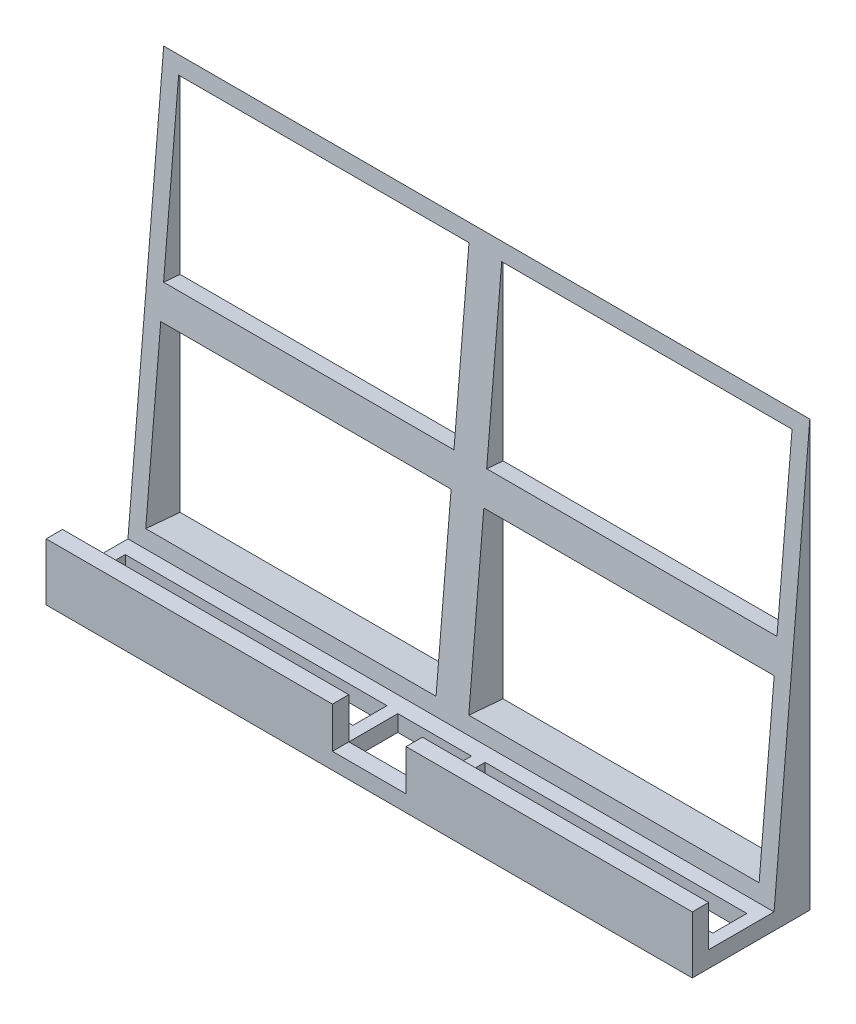
from build123d import *

# Parameters (mm, degrees)
CROQUIS1_W              = 79
CROQUIS1_H              = 14.37
SALIENTE_EXTRUIR1_DEPTH = 2
SALIENTE_EXTRUIR2_DEPTH = 79
CROQUIS4_W              = 35
CROQUIS4_H              = 2
SALIENTE_EXTRUIR3_DEPTH = 5
CORTAR_EXTRUIR1_REACH   = 66.124
CROQUIS5_W              = 9
CROQUIS5_H              = 9.995566824
CORTAR_EXTRUIR2_REACH   = 68.213
CROQUIS6_W              = 35.5
CROQUIS6_H              = 21.095495938
CROQUIS6_H_2            = 21.095495939
CORTAR_EXTRUIR3_REACH   = 66.124
CROQUIS7_W              = 32
CROQUIS7_H              = 4.169878309
SALIENTE_EXTRUIR4_REACH = 70.495
CROQUIS8_W              = 2
CROQUIS8_H              = 2
SALIENTE_EXTRUIR5_REACH = 70.495
CROQUIS11_W             = 2
CROQUIS11_H             = 2


with BuildPart() as part:
    # Croquis1 → Saliente-Extruir1 (new body)
    with BuildSketch(Plane(origin=(0, 0, 0), x_dir=(1, 0, 0), z_dir=(0, 1, 0))):
        Rectangle(CROQUIS1_W, CROQUIS1_H)
    extrude(amount=SALIENTE_EXTRUIR1_DEPTH)

    # Croquis2 → Saliente-Extruir2 (add)
    with BuildSketch(Plane(origin=(39.5, 0, 0), x_dir=(0, 0, -1), z_dir=(1, 0, 0))):
        Polygon((2.810566824, 2), (7.185, 52), (7.185, 2), align=None)
    extrude(amount=-SALIENTE_EXTRUIR2_DEPTH)

    # Croquis4 → Saliente-Extruir3 (add)
    with BuildSketch(Plane(origin=(0, 2, 0), x_dir=(1, 0, 0), z_dir=(0, 1, 0))):
        with Locations((-22, -6.185)):
            Rectangle(CROQUIS4_W, CROQUIS4_H)
    saliente_extruir3 = extrude(amount=SALIENTE_EXTRUIR3_DEPTH)

    # Simetría1: Saliente-Extruir3 across plane
    add(saliente_extruir3.mirror(Plane(origin=(0, 0, 0), x_dir=(0, 0, 1), z_dir=(1, 0, 0))))

    # Croquis5 → Cortar-Extruir1 (cut, up to next)
    with BuildSketch(Plane(origin=(0, 2, 0), x_dir=(1, 0, 0), z_dir=(0, 1, 0)), mode=Mode.PRIVATE) as cortar_extruir1_sk1:
        with Locations((0, -2.187216588)):
            Rectangle(CROQUIS5_W, CROQUIS5_H)
    cortar_extruir1_tool1 = extrude(cortar_extruir1_sk1.sketch, amount=-CORTAR_EXTRUIR1_REACH, mode=Mode.PRIVATE) & part.part
    add(cortar_extruir1_tool1.solids().sort_by_distance((0, 2, 2.187217))[0], mode=Mode.SUBTRACT)

    # Cortar-Extruir2: up to this plane
    cortar_extruir2_end = Plane(origin=(39.5, 2, -7.185), z_dir=(0, 0, 1))
    # Croquis6 → Cortar-Extruir2 (cut, up to the surface)
    with BuildSketch(Plane(origin=(0, -0.228832657, -2.615569233), x_dir=(1, 0, 0), z_dir=(0, 0.0871557427476544, 0.996194698091746)), mode=Mode.PRIVATE) as cortar_extruir2_sk1:
        with Locations((-19.75, 39.880590343)):
            Rectangle(CROQUIS6_W, CROQUIS6_H)
    cortar_extruir2_tool1 = split(extrude(cortar_extruir2_sk1.sketch, amount=-CORTAR_EXTRUIR2_REACH, mode=Mode.PRIVATE), bisect_by=cortar_extruir2_end, keep=Keep.BOTH, mode=Mode.PRIVATE)
    add(cortar_extruir2_tool1.solids().sort_by_distance((-19.75, 39.5, -6.091392))[0], mode=Mode.SUBTRACT)
    # Croquis6 → Cortar-Extruir2 (cut, up to the surface)
    with BuildSketch(Plane(origin=(0, -0.228832657, -2.615569233), x_dir=(1, 0, 0), z_dir=(0, 0.0871557427476544, 0.996194698091746)), mode=Mode.PRIVATE) as cortar_extruir2_sk2:
        with Locations((19.75, 39.880590343)):
            Rectangle(CROQUIS6_W, CROQUIS6_H)
    cortar_extruir2_tool2 = split(extrude(cortar_extruir2_sk2.sketch, amount=-CORTAR_EXTRUIR2_REACH, mode=Mode.PRIVATE), bisect_by=cortar_extruir2_end, keep=Keep.BOTH, mode=Mode.PRIVATE)
    add(cortar_extruir2_tool2.solids().sort_by_distance((19.75, 39.5, -6.091392))[0], mode=Mode.SUBTRACT)
    # Croquis6 → Cortar-Extruir2 (cut, up to the surface)
    with BuildSketch(Plane(origin=(0, -0.228832657, -2.615569233), x_dir=(1, 0, 0), z_dir=(0, 0.0871557427476544, 0.996194698091746)), mode=Mode.PRIVATE) as cortar_extruir2_sk3:
        with Locations((19.75, 14.785094405)):
            Rectangle(CROQUIS6_W, CROQUIS6_H_2)
    cortar_extruir2_tool3 = split(extrude(cortar_extruir2_sk3.sketch, amount=-CORTAR_EXTRUIR2_REACH, mode=Mode.PRIVATE), bisect_by=cortar_extruir2_end, keep=Keep.BOTH, mode=Mode.PRIVATE)
    add(cortar_extruir2_tool3.solids().sort_by_distance((19.75, 14.5, -3.904175))[0], mode=Mode.SUBTRACT)
    # Croquis6 → Cortar-Extruir2 (cut, up to the surface)
    with BuildSketch(Plane(origin=(0, -0.228832657, -2.615569233), x_dir=(1, 0, 0), z_dir=(0, 0.0871557427476544, 0.996194698091746)), mode=Mode.PRIVATE) as cortar_extruir2_sk4:
        with Locations((-19.75, 14.785094405)):
            Rectangle(CROQUIS6_W, CROQUIS6_H_2)
    cortar_extruir2_tool4 = split(extrude(cortar_extruir2_sk4.sketch, amount=-CORTAR_EXTRUIR2_REACH, mode=Mode.PRIVATE), bisect_by=cortar_extruir2_end, keep=Keep.BOTH, mode=Mode.PRIVATE)
    add(cortar_extruir2_tool4.solids().sort_by_distance((-19.75, 14.5, -3.904175))[0], mode=Mode.SUBTRACT)

    # Croquis7 → Cortar-Extruir3 (cut, up to next)
    with BuildSketch(Plane(origin=(0, 2, 0), x_dir=(1, 0, 0), z_dir=(0, 1, 0)), mode=Mode.PRIVATE) as cortar_extruir3_sk1:
        with Locations((22, -1.100060846)):
            Rectangle(CROQUIS7_W, CROQUIS7_H)
    cortar_extruir3_tool1 = extrude(cortar_extruir3_sk1.sketch, amount=-CORTAR_EXTRUIR3_REACH, mode=Mode.PRIVATE) & part.part
    cortar_extruir3 = cortar_extruir3_tool1.solids().sort_by_distance((22, 2, 1.100061))[0]
    add(cortar_extruir3, mode=Mode.SUBTRACT)

    # Simetría4: Cortar-Extruir3 across plane
    add(cortar_extruir3.mirror(Plane(origin=(0, 0, 0), x_dir=(0, 0, 1), z_dir=(1, 0, 0))), mode=Mode.SUBTRACT)

    # Croquis8 → Saliente-Extruir4 (add, up to next)
    with BuildSketch(Plane(origin=(-4.5, 0, 0), x_dir=(0, 0, -1), z_dir=(1, 0, 0)), mode=Mode.PRIVATE) as saliente_extruir4_sk1:
        with Locations((-6.185, 1)):
            Rectangle(CROQUIS8_W, CROQUIS8_H)
    saliente_extruir4_tool1 = extrude(saliente_extruir4_sk1.sketch, amount=SALIENTE_EXTRUIR4_REACH, mode=Mode.PRIVATE) - part.part
    add(saliente_extruir4_tool1.solids().sort_by_distance((-4.5, 1, 6.185))[0])

    # Croquis11 → Saliente-Extruir5 (add, up to next)
    with BuildSketch(Plane(origin=(-4.5, 0, 0), x_dir=(0, 0, -1), z_dir=(1, 0, 0)), mode=Mode.PRIVATE) as saliente_extruir5_sk1:
        with Locations((1.810566824, 1)):
            Rectangle(CROQUIS11_W, CROQUIS11_H)
    saliente_extruir5_tool1 = extrude(saliente_extruir5_sk1.sketch, amount=SALIENTE_EXTRUIR5_REACH, mode=Mode.PRIVATE) - part.part
    add(saliente_extruir5_tool1.solids().sort_by_distance((-4.5, 1, -1.810567))[0])


solid = part.part
